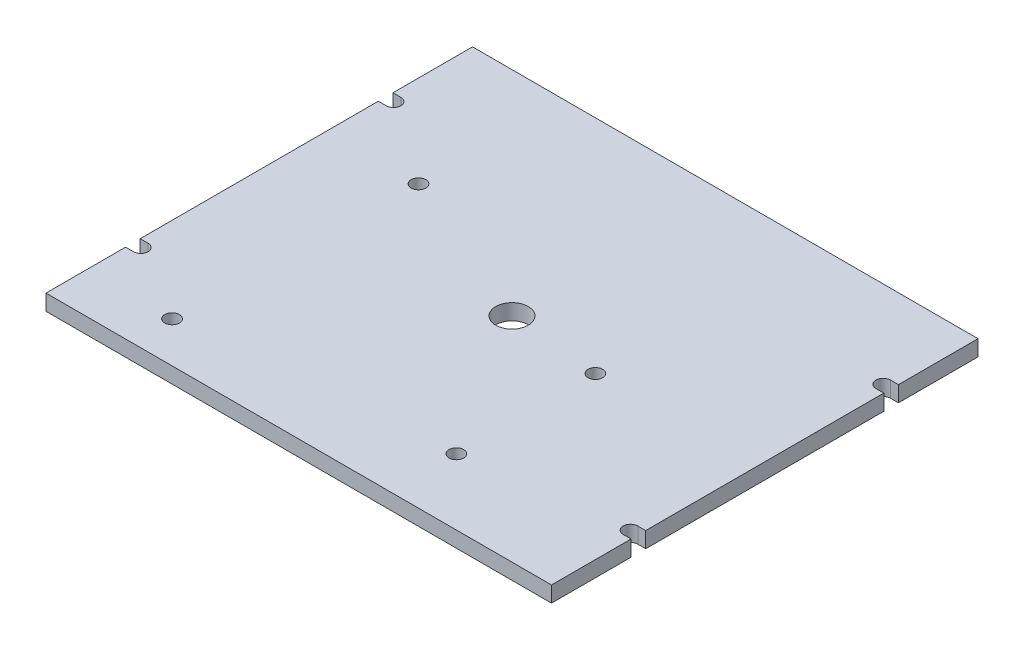
from build123d import *

# Parameters (mm, degrees)
SKETCH1_W               = 101.6
SKETCH1_H               = 85.725
BOSS_EXTRUDE1_DEPTH     = 3.175
F_4_CLEARANCE_HOLE1_D   = 2.9464
CUT_EXTRUDE1_DEPTH      = 67.542576831
F_1_4_CLEARANCE_HOLE1_D = 6.5278


with BuildPart() as part:
    # Sketch1 → Boss-Extrude1 (new body)
    with BuildSketch(Plane(origin=(0, 0, 0), x_dir=(1, 0, 0), z_dir=(0, 1, 0))):
        Rectangle(SKETCH1_W, SKETCH1_H)
    extrude(amount=BOSS_EXTRUDE1_DEPTH)

    # #4 Clearance Hole1 (through all)
    with Locations(Plane(origin=(0, 0, 0), x_dir=(-1, 0, 0), z_dir=(0, -1, 0))):
        with Locations((-18.415, -1.6525), (-18.415, -29.5925), (33.655, -34.6725), (32.385, 13.5875)):
            Hole(F_4_CLEARANCE_HOLE1_D / 2)

    # Sketch4 → Cut-Extrude1 (cut, through all)
    with BuildSketch(Plane.XZ):
        with BuildLine():
            Line((49.2125, -26.8732), (50.8, -26.8732))
            Line((50.8, -26.8732), (50.8, -23.9268))
            Line((50.8, -23.9268), (49.2125, -23.9268))
            ThreePointArc((49.2125, -23.9268), (47.7393, -25.4), (49.2125, -26.8732))
        make_face()
        with BuildLine():
            Line((49.2125, 26.8732), (50.8, 26.8732))
            Line((50.8, 26.8732), (50.8, 23.9268))
            Line((50.8, 23.9268), (49.2125, 23.9268))
            ThreePointArc((49.2125, 23.9268), (47.7393, 25.4), (49.2125, 26.8732))
        make_face()
        with BuildLine():
            Line((-49.2125, 26.8732), (-50.8, 26.8732))
            Line((-50.8, 26.8732), (-50.8, 23.9268))
            Line((-50.8, 23.9268), (-49.2125, 23.9268))
            ThreePointArc((-49.2125, 23.9268), (-47.7393, 25.4), (-49.2125, 26.8732))
        make_face()
        with BuildLine():
            Line((-49.2125, -23.9268), (-50.8, -23.9268))
            Line((-50.8, -23.9268), (-50.8, -26.8732))
            Line((-50.8, -26.8732), (-49.2125, -26.8732))
            ThreePointArc((-49.2125, -26.8732), (-47.7393, -25.4), (-49.2125, -23.9268))
        make_face()
    extrude(amount=-CUT_EXTRUDE1_DEPTH, mode=Mode.SUBTRACT)

    # 1/4 Clearance Hole1 (through all)
    with Locations(Plane(origin=(0, 0, 0), x_dir=(-1, 0, 0), z_dir=(0, -1, 0))):
        with Locations((0, 0)):
            Hole(F_1_4_CLEARANCE_HOLE1_D / 2)


solid = part.part
